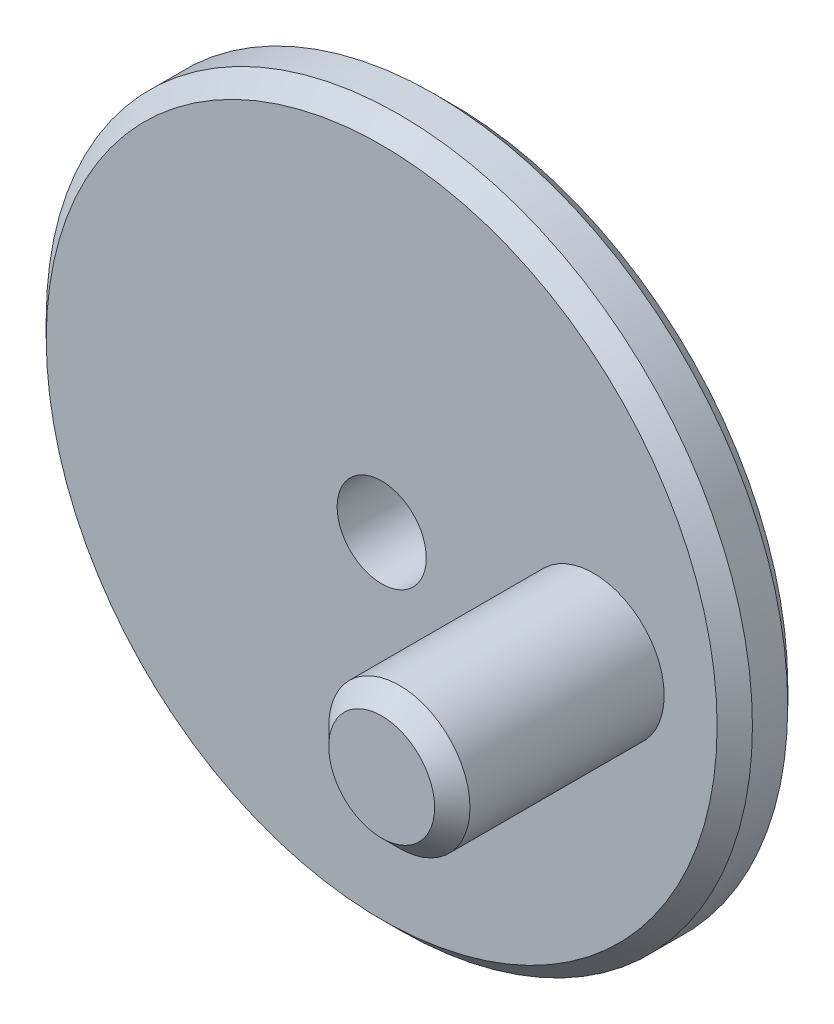
from build123d import *

# Parameters (mm, degrees)
SKETCH1_R           = 20
BOSS_EXTRUDE1_DEPTH = 2
SKETCH2_R           = 4
BOSS_EXTRUDE2_DEPTH = 12
CUT_EXTRUDE1_REACH  = 34.496
SKETCH3_R           = 2.525
CHAMFER2_SIZE       = 1


with BuildPart() as part:
    # Sketch1 → Boss-Extrude1 (new, symmetric)
    with BuildSketch(Plane.XY):
        Circle(SKETCH1_R)
    extrude(amount=BOSS_EXTRUDE1_DEPTH, both=True)

    # Sketch2 → Boss-Extrude2 (add)
    with BuildSketch(Plane.XY.offset(2)):
        with Locations((12, 0)):
            Circle(SKETCH2_R)
    extrude(amount=BOSS_EXTRUDE2_DEPTH)

    # Sketch3 → Cut-Extrude1 (cut, up to next)
    with BuildSketch(Plane(origin=(0, 0, -2), x_dir=(-1, 0, 0), z_dir=(0, 0, -1)), mode=Mode.PRIVATE) as cut_extrude1_sk1:
        Circle(SKETCH3_R)
    cut_extrude1_tool1 = extrude(cut_extrude1_sk1.sketch, amount=-CUT_EXTRUDE1_REACH, mode=Mode.PRIVATE) & part.part
    add(cut_extrude1_tool1.solids().sort_by_distance((0, 0, -2))[0], mode=Mode.SUBTRACT)

    # Chamfer2
    chamfer2_edges = [part.edges().sort_by_distance(p)[0] for p in [
        (-20, 0, -2),
        (-20, 0, 2),
        (8, 0, 14),
    ]]
    chamfer(chamfer2_edges, length=CHAMFER2_SIZE)


solid = part.part
